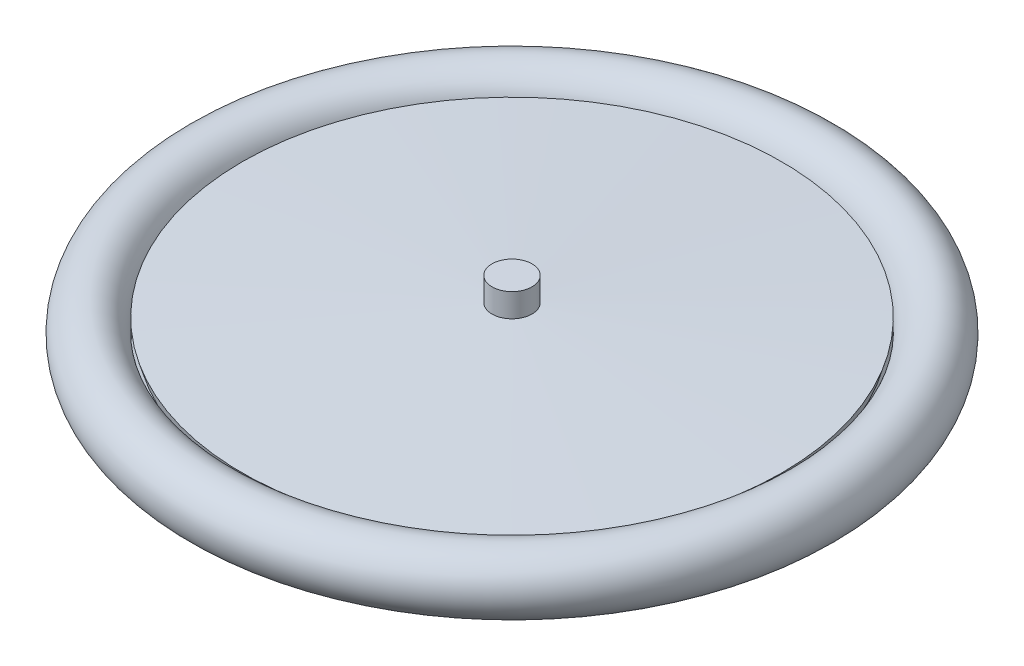
from build123d import *

# Parameters (mm, degrees)
ESQUISSE1_R = 15


with BuildPart() as part:
    # Esquisse1 → Révolution1 (revolve)
    with BuildSketch(Plane.XY):
        with Locations((150, 25)):
            Circle(ESQUISSE1_R)
        Polygon((0, 50), (10, 50), (10, 38.192482169), (135, 31.79272492), (133.015042214, 25), (135, 18.20727508), (10, 11.807517831), (10, 0), (0, 0), align=None)
    revolve(axis=Axis((0, 0, 0), (0, 1, 0)))


solid = part.part
